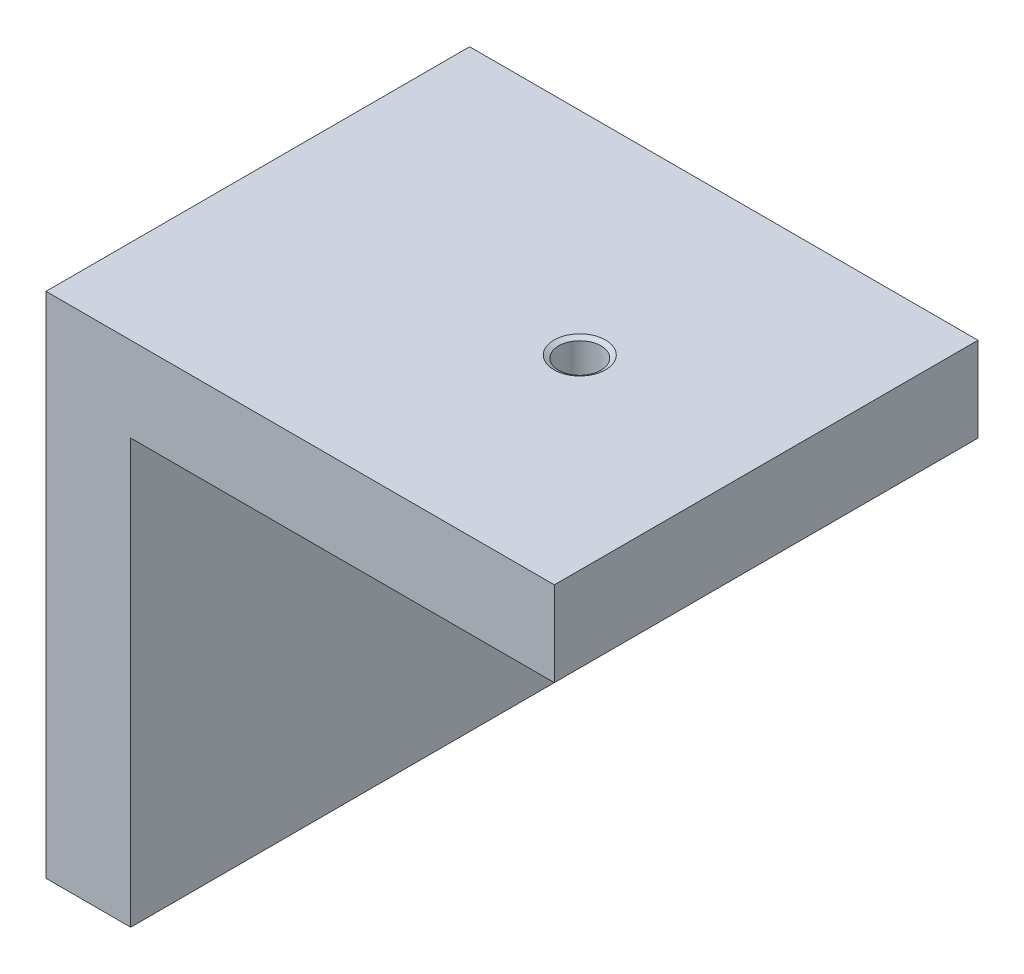
from build123d import *

# Parameters (mm, degrees)
ESTRUSIONE_ESTRUSIONE1_DEPTH    = 25
SCHIZZO2_R                      = 3.5
TAGLIO_ESTRUSIONE1_DEPTH        = 25
FORO_FILETTATO_M3_1_D           = 2.5
FORO_FILETTATO_M3_1_DEPTH       = 8.5
FORO_FILETTATO_M3_1_CSINK_D     = 3.05
FORO_FILETTATO_M3_1_CSINK_ANGLE = 120
FORO_FILETTATO_M3_1_TIP         = 0.751075774


with BuildPart() as part:
    # Schizzo1 → Estrusione-Estrusione1 (new body)
    with BuildSketch(Plane.XY):
        Polygon((0, 0), (0, 30), (30, 30), (30, 25), (5, 25), (5, 0), align=None)
    extrude(amount=ESTRUSIONE_ESTRUSIONE1_DEPTH)

    # Schizzo2 → Taglio-Estrusione1 (cut)
    with BuildSketch(Plane.ZY):
        with Locations((12.5, 18)):
            Circle(SCHIZZO2_R)
    extrude(amount=-TAGLIO_ESTRUSIONE1_DEPTH, mode=Mode.SUBTRACT)

    # Foro filettato M3-1
    with Locations(Plane(origin=(0, 30, 0), x_dir=(1, 0, 0), z_dir=(0, 1, 0))):
        with Locations((19, -12.5)):
            CounterSinkHole(FORO_FILETTATO_M3_1_D / 2, FORO_FILETTATO_M3_1_CSINK_D / 2, depth=FORO_FILETTATO_M3_1_DEPTH, counter_sink_angle=FORO_FILETTATO_M3_1_CSINK_ANGLE)
            with Locations((0, 0, -(FORO_FILETTATO_M3_1_DEPTH + FORO_FILETTATO_M3_1_TIP / 2))):  # 118° drill point
                Cone(0, FORO_FILETTATO_M3_1_D / 2, FORO_FILETTATO_M3_1_TIP, mode=Mode.SUBTRACT)


solid = part.part
